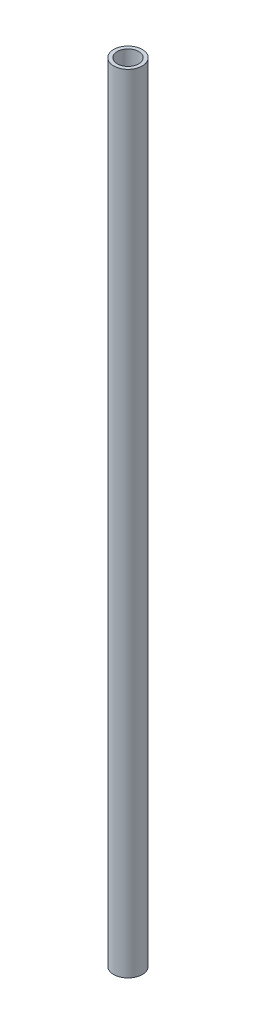
from build123d import *

# Parameters (mm, degrees)
SKETCH2_R   = 4
SKETCH2_R_2 = 3


with BuildPart() as part:
    # Sweep1: sweep along a path in Sketch1
    with BuildLine(Plane.XY) as sweep1_path:
        Line((0, 0), (0, 220))
    # Sketch2 → Sweep1 (sweep)
    with BuildSketch(Plane(origin=(0, 0, 0), x_dir=(1, 0, 0), z_dir=(0, 1, 0))):
        Circle(SKETCH2_R)
        Circle(SKETCH2_R_2, mode=Mode.SUBTRACT)
    sweep(path=sweep1_path.line)


solid = part.part
